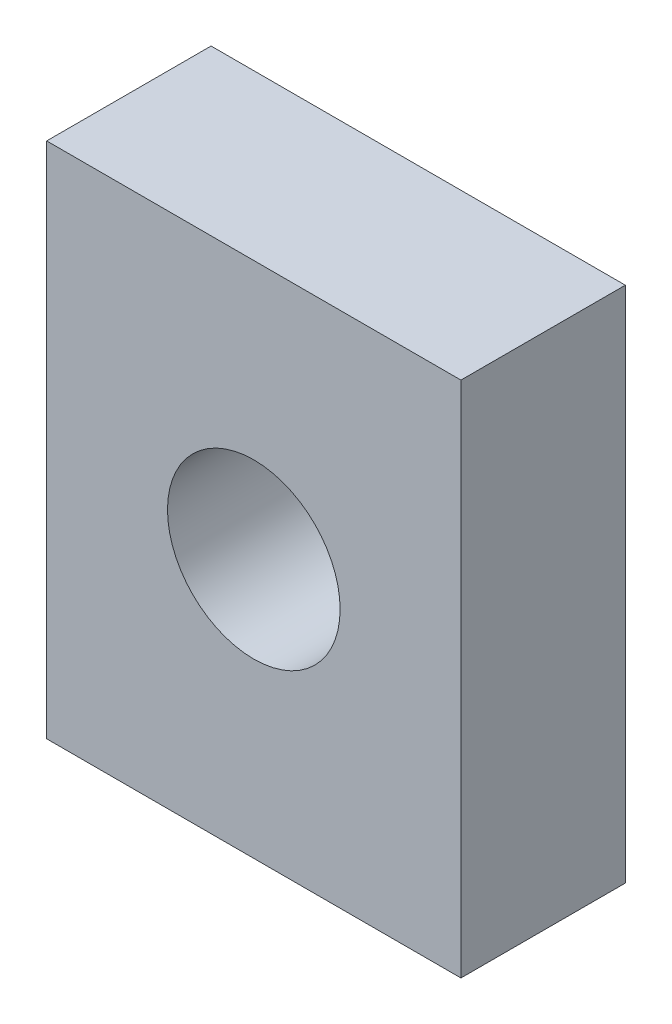
from build123d import *

# Parameters (mm, degrees)
SKETCH_1_W      = 120
SKETCH_1_H      = 150
SKETCH_1_R      = 25
EXTRUDE_1_DEPTH = 47.619047619


with BuildPart() as part:
    # 草图1 → 拉伸1 (new body)
    with BuildSketch(Plane.XY):
        Rectangle(SKETCH_1_W, SKETCH_1_H)
        with Locations(Location((0, 0, 0), (0, 0, 180))):
            Circle(SKETCH_1_R, mode=Mode.SUBTRACT)
    extrude(amount=EXTRUDE_1_DEPTH)


solid = part.part
